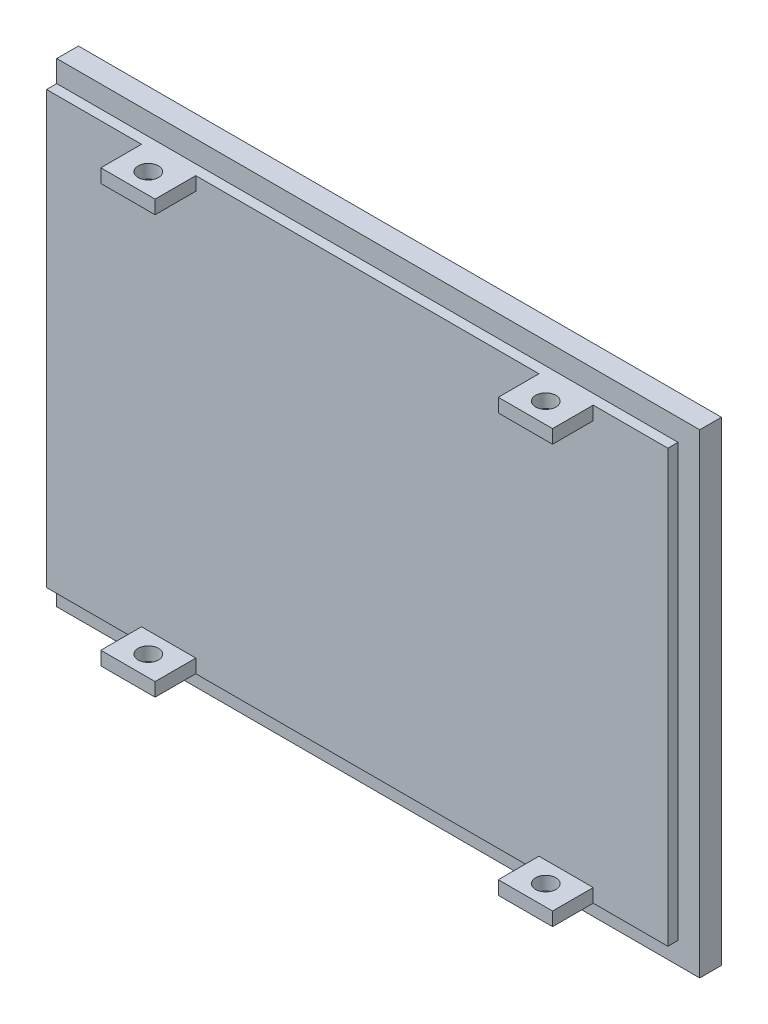
from build123d import *

# Parameters (mm, degrees)
SKETCH_1_W          = 94.8
SKETCH_1_H          = 70
EXTRUDE_1_DEPTH     = 3.2
SKETCH_3_W          = 88.6
SKETCH_3_H          = 63.6
EXTRUDE_2_DEPTH     = 1.5
SKETCH_4_W          = 8
SKETCH_4_H          = 2
EXTRUDE_3_DEPTH     = 6
SKETCH_5_R          = 1.5
CUT_EXTRUDE_1_DEPTH = 100
SKETCH_6_W          = 3
SKETCH_6_H          = 63.6
EXTRUDE_4_DEPTH     = 1.5


with BuildPart() as part:
    # 草图1 → 凸台-拉伸1 (new body)
    with BuildSketch(Plane.XY):
        with Locations((0.1, 0)):
            Rectangle(SKETCH_1_W, SKETCH_1_H)
    extrude(amount=EXTRUDE_1_DEPTH)

    # 草图3 → 凸台-拉伸2 (add)
    with BuildSketch(Plane.XY.offset(3.2)):
        Rectangle(SKETCH_3_W, SKETCH_3_H)
    extrude(amount=EXTRUDE_2_DEPTH)

    # 草图4 → 凸台-拉伸3 (add)
    with BuildSketch(Plane.XY.offset(4.7)):
        with Locations((29.3, 30.8)):
            Rectangle(SKETCH_4_W, SKETCH_4_H)
        with Locations((29.3, -30.8)):
            Rectangle(SKETCH_4_W, SKETCH_4_H)
        with Locations((-29.3, -30.8)):
            Rectangle(SKETCH_4_W, SKETCH_4_H)
        with Locations((-29.3, 30.8)):
            Rectangle(SKETCH_4_W, SKETCH_4_H)
    extrude(amount=EXTRUDE_3_DEPTH)

    # 草图5 → 切除-拉伸1 (cut)
    with BuildSketch(Plane(origin=(0, 31.8, 0), x_dir=(1, 0, 0), z_dir=(0, 1, 0))):
        with Locations(Location((29.3, -7.7, 0), (0, 0, 180))):
            Circle(SKETCH_5_R)
        with Locations(Location((-29.3, -7.7, 0), (0, 0, 180))):
            Circle(SKETCH_5_R)
    extrude(amount=-CUT_EXTRUDE_1_DEPTH, mode=Mode.SUBTRACT)

    # 草图6 → 凸台-拉伸4 (add)
    with BuildSketch(Plane.XY.offset(3.2)):
        with Locations((-45.8, 0)):
            Rectangle(SKETCH_6_W, SKETCH_6_H)
    extrude(amount=EXTRUDE_4_DEPTH)


solid = part.part
